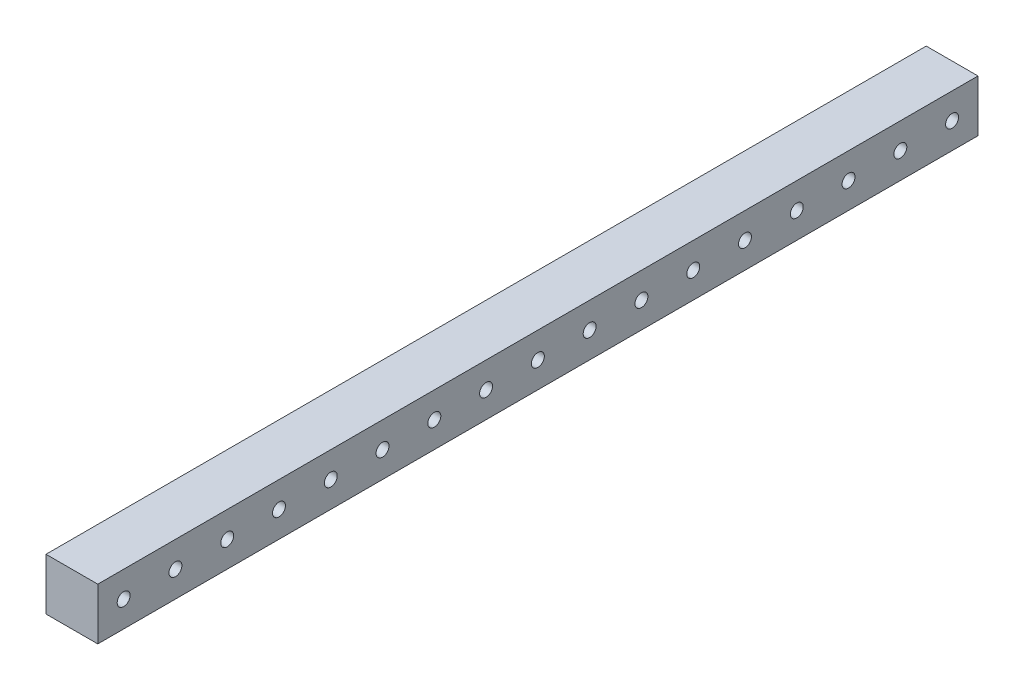
from build123d import *

# Parameters (mm, degrees)
SKETCH1_W             = 20
SKETCH1_H             = 20
BOSS_EXTRUDE1_DEPTH   = 340
F_5_0MM_DOWEL_HOLE1_D = 5
LPATTERN2_COUNT       = 17
LPATTERN2_PITCH       = 20


with BuildPart() as part:
    # Sketch1 → Boss-Extrude1 (new body)
    with BuildSketch(Plane.XY):
        Rectangle(SKETCH1_W, SKETCH1_H)
    extrude(amount=BOSS_EXTRUDE1_DEPTH)

    # Ø5.0mm Dowel Hole1 (through all)
    with Locations(Plane(origin=(10, 0, 0), x_dir=(0, 0, -1), z_dir=(1, 0, 0))):
        with Locations((-10, 0)):
            f_5_0mm_dowel_hole1 = Hole(F_5_0MM_DOWEL_HOLE1_D / 2)

    # LPattern2: Ø5.0mm Dowel Hole1 ×17
    with Locations(*[(0, 0, i * LPATTERN2_PITCH) for i in range(1, LPATTERN2_COUNT)]):
        add(f_5_0mm_dowel_hole1, mode=Mode.SUBTRACT)


solid = part.part
